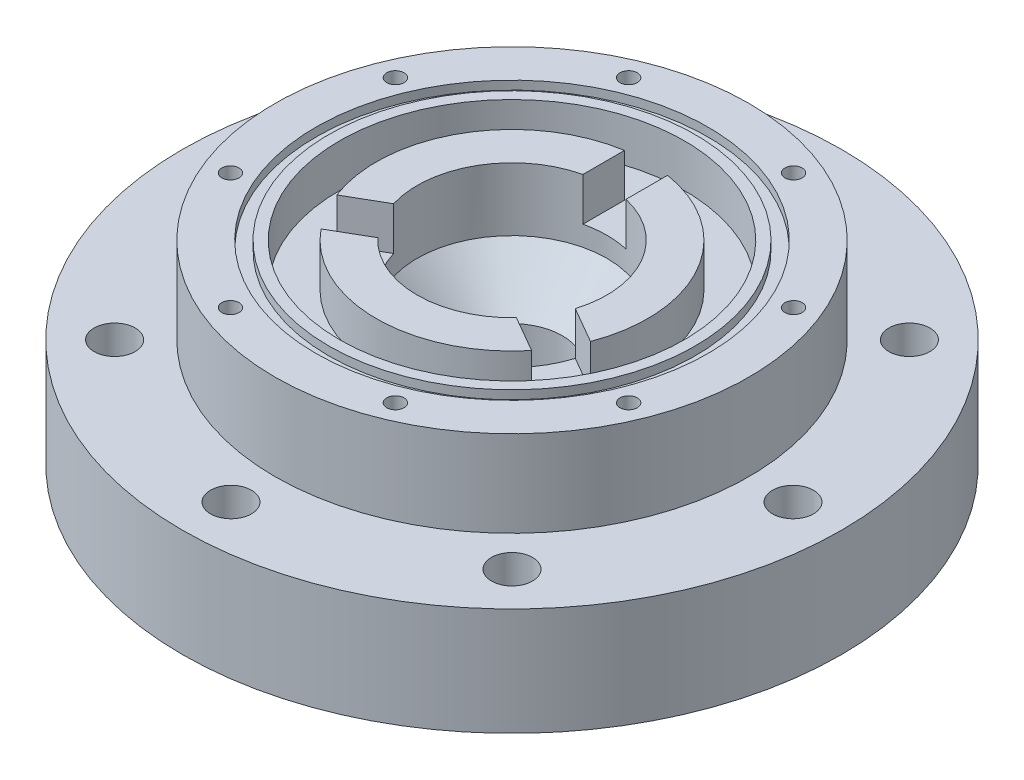
from build123d import *

# Parameters (mm, degrees)
SKETCH4_R          = 4.7625
CUT_EXTRUDE2_DEPTH = 114.707959264
CIRPATTERN1_COUNT  = 8
SKETCH6_R          = 40
SKETCH6_R_2        = 31.5
CUT_EXTRUDE3_DEPTH = 10
SKETCH7_W          = 10
SKETCH7_H          = 10.050043706
CUT_EXTRUDE4_DEPTH = 10
CIRPATTERN2_COUNT  = 3
SKETCH9_R          = 2
CUT_EXTRUDE5_DEPTH = 10
CIRPATTERN3_COUNT  = 8
SKETCH10_R         = 45.5
SKETCH10_R_2       = 42.5
CUT_EXTRUDE6_DEPTH = 2


with BuildPart() as part:
    # Sketch3 → Revolve1 (revolve)
    with BuildSketch(Plane(origin=(0, 0, 0), x_dir=(0, 0, -1), z_dir=(1, 0, 0))):
        with BuildLine():
            Line((76.5, 15), (55, 15))
            Line((55, 15), (55, 35))
            Line((55, 35), (22.025, 35))
            Line((22.025, 35), (22.025, 20.36))
            Line((22.025, 20.36), (11.665, 10))
            Line((11.665, 10), (11.665, 0))
            Line((11.665, 0), (16.665, 0))
            ThreePointArc((16.665, 0), (37.471852779, 3.234070807), (53.85, -10))
            Line((53.85, -10), (76.5, -10))
            Line((76.5, -10), (76.5, 15))
        make_face()
    revolve(axis=Axis((0, 0, 0), (0, 1, 0)))

    # Sketch4 → Cut-Extrude2 (cut, symmetric)
    with BuildSketch(Plane(origin=(0, 0, 0), x_dir=(1, 0, 0), z_dir=(0, 1, 0))):
        with Locations(Location((-65.2, 0, 0), (0, 0, 270))):
            Circle(SKETCH4_R)
    cut_extrude2 = extrude(amount=CUT_EXTRUDE2_DEPTH, both=True, mode=Mode.SUBTRACT)

    # CirPattern1: Cut-Extrude2 ×8 about axis
    cirpattern1_axis = Axis((0, 0, 0), (0, 1, 0))
    for i in range(1, CIRPATTERN1_COUNT):
        add(cut_extrude2.rotate(cirpattern1_axis, i * 360 / CIRPATTERN1_COUNT), mode=Mode.SUBTRACT)

    # Sketch6 → Cut-Extrude3 (cut)
    with BuildSketch(Plane(origin=(0, 35, 0), x_dir=(1, 0, 0), z_dir=(0, 1, 0))):
        with Locations(Location((0, 0, 0), (0, 0, 270))):
            Circle(SKETCH6_R)
        with Locations(Location((0, 0, 0), (0, 0, 270))):
            Circle(SKETCH6_R_2, mode=Mode.SUBTRACT)
    extrude(amount=-CUT_EXTRUDE3_DEPTH, mode=Mode.SUBTRACT)

    # Sketch7 → Cut-Extrude4 (cut)
    with BuildSketch(Plane(origin=(0, 35, 0), x_dir=(1, 0, 0), z_dir=(0, 1, 0))):
        with Locations((0, 26.474978147)):
            Rectangle(SKETCH7_W, SKETCH7_H)
    cut_extrude4 = extrude(amount=-CUT_EXTRUDE4_DEPTH, mode=Mode.SUBTRACT)

    # CirPattern2: Cut-Extrude4 ×3 about axis
    cirpattern2_axis = Axis((0, 0, 0), (0, 1, 0))
    for i in range(1, CIRPATTERN2_COUNT):
        add(cut_extrude4.rotate(cirpattern2_axis, i * 360 / CIRPATTERN2_COUNT), mode=Mode.SUBTRACT)

    # Sketch9 → Cut-Extrude5 (cut)
    with BuildSketch(Plane(origin=(0, 35, 0), x_dir=(1, 0, 0), z_dir=(0, 1, 0))):
        with Locations(Location((46.193976626, 19.134171618, 0), (0, 0, 270))):
            Circle(SKETCH9_R)
    cut_extrude5 = extrude(amount=-CUT_EXTRUDE5_DEPTH, mode=Mode.SUBTRACT)

    # CirPattern3: Cut-Extrude5 ×8 about axis
    cirpattern3_axis = Axis((0, 0, 0), (0, 1, 0))
    for i in range(1, CIRPATTERN3_COUNT):
        add(cut_extrude5.rotate(cirpattern3_axis, i * 360 / CIRPATTERN3_COUNT), mode=Mode.SUBTRACT)

    # Sketch10 → Cut-Extrude6 (cut)
    with BuildSketch(Plane(origin=(0, 35, 0), x_dir=(1, 0, 0), z_dir=(0, 1, 0))):
        with Locations(Location((0, 0, 0), (0, 0, 270))):
            Circle(SKETCH10_R)
        with Locations(Location((0, 0, 0), (0, 0, 270))):
            Circle(SKETCH10_R_2, mode=Mode.SUBTRACT)
    extrude(amount=-CUT_EXTRUDE6_DEPTH, mode=Mode.SUBTRACT)


solid = part.part
